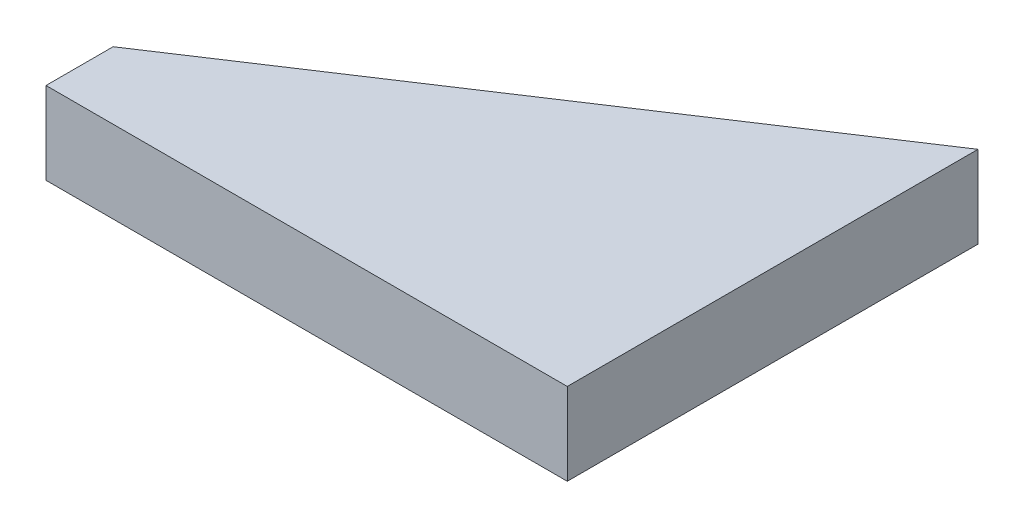
from build123d import *

# Parameters (mm, degrees)
BOSS_EXTRUDE1_DEPTH = 10


with BuildPart() as part:
    # Sketch1 → Boss-Extrude1 (new body)
    with BuildSketch(Plane(origin=(0, 0, 0), x_dir=(1, 0, 0), z_dir=(0, 1, 0))):
        Polygon((12.4, 0), (75.857785919, 0), (75.857785919, 50), (12.4, 8.173188717), align=None)
    extrude(amount=BOSS_EXTRUDE1_DEPTH)


solid = part.part
